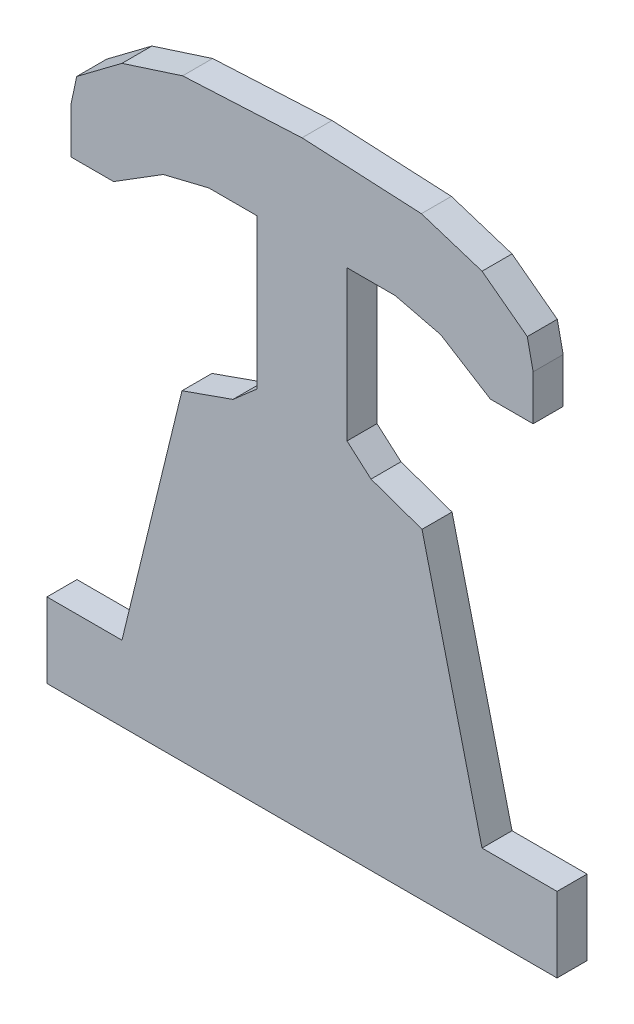
from build123d import *

# Parameters (mm, degrees)
BOSS_EXTRUDE1_DEPTH = 10


with BuildPart() as part:
    # Sketch1 → Boss-Extrude1 (new body)
    with BuildSketch(Plane.XY):
        Polygon((40, 107), (23, 113), (15, 120), (15, 170), (31.055768347, 170), (46.225269869, 166.291261256), (62.793848643, 155.971389715), (77.033804463, 155.971389715), (77.033804463, 170.971389715), (75.085424996, 180.171389715), (60, 191.5), (39.787088413, 198), (0, 200), (-39.787088413, 198), (-60, 191.5), (-75.085424996, 180.171389715), (-77.033804463, 170.971389715), (-77.033804463, 155.971389715), (-62.793848643, 155.971389715), (-46.225269869, 166.291261256), (-31.055768347, 170), (-15, 170), (-15, 120), (-23, 113), (-40, 107), (-60, 25), (-85, 25), (-85, 0), (85, 0), (85, 25), (60, 25), align=None)
    extrude(amount=BOSS_EXTRUDE1_DEPTH)


solid = part.part
